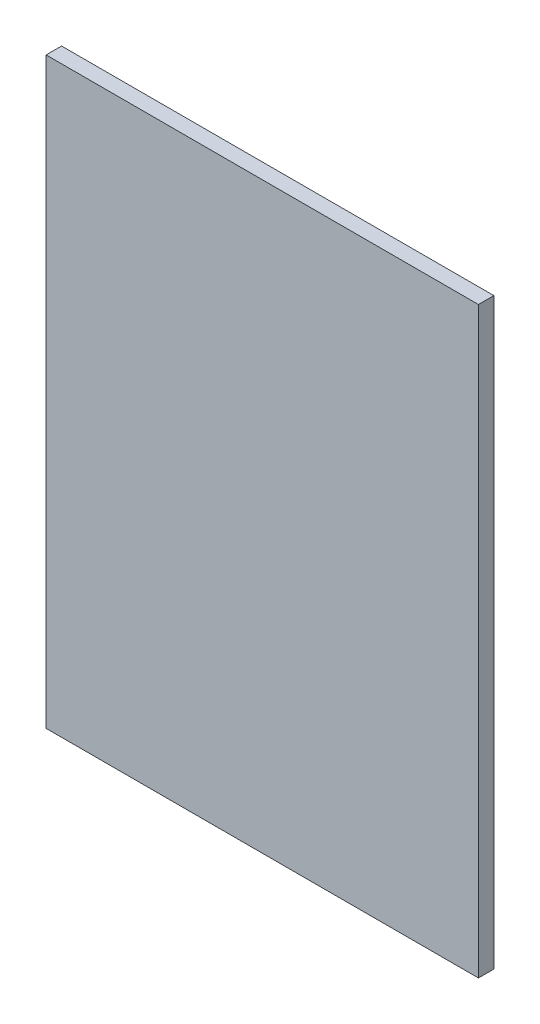
from build123d import *

# Parameters (mm, degrees)
SKETCH1_W           = 126
SKETCH1_H           = 170
BOSS_EXTRUDE1_DEPTH = 4.5


with BuildPart() as part:
    # Sketch1 → Boss-Extrude1 (new body)
    with BuildSketch(Plane.XY):
        Rectangle(SKETCH1_W, SKETCH1_H)
    extrude(amount=BOSS_EXTRUDE1_DEPTH)


solid = part.part
